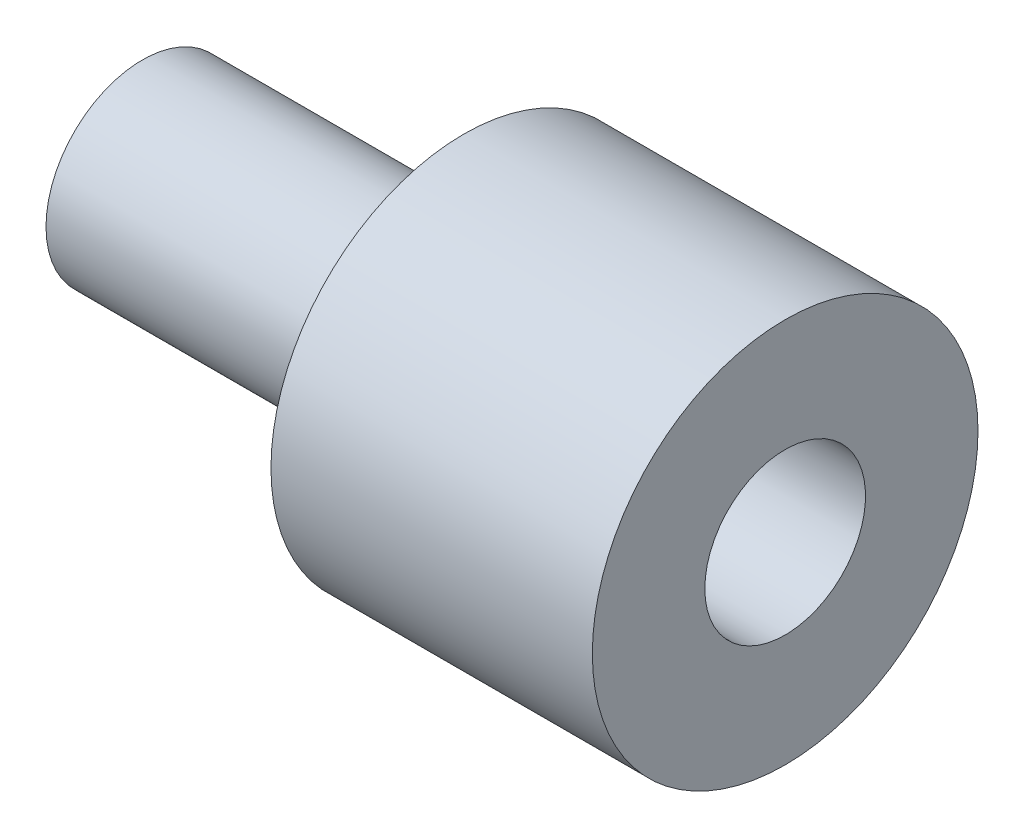
from build123d import *


with BuildPart() as part:
    # Sketch1 → Revolve1 (revolve)
    with BuildSketch(Plane.XY, mode=Mode.PRIVATE) as revolve1_sk:
        Polygon((0, 0), (0, 5), (12, 5), (12, 12), (-8, 12), (-8, 6), (-28, 6), (-28, 0), align=None)
    revolve(revolve1_sk.sketch.rotate(Axis((-28, 0, 0), (1, 0, 0)), 90), axis=Axis((-28, 0, 0), (1, 0, 0)))


solid = part.part
